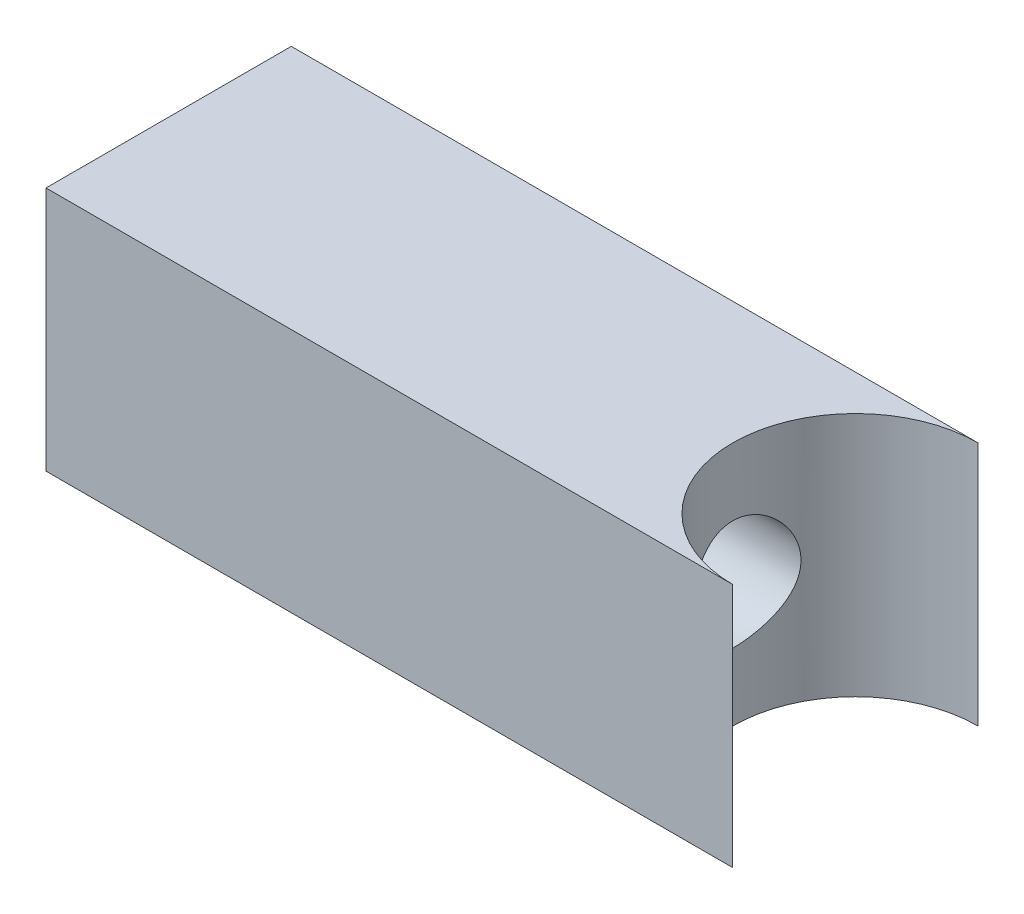
from build123d import *

# Parameters (mm, degrees)
SKETCH10_W                                           = 31.75
SKETCH10_H                                           = 31.75
SKETCH10_W_2                                         = 2.54
SKETCH10_H_2                                         = 5.08
SKETCH10_W_3                                         = 5.08
SKETCH10_H_3                                         = 2.54
BOSS_EXTRUDE3_DEPTH                                  = 12.7
SKETCH11_W                                           = 31.75
SKETCH11_H                                           = 31.75
BOSS_EXTRUDE4_DEPTH                                  = 76.2
CBORE_FOR_1_4_BINDING_HEAD_MACHINE_SCREW_D           = 6.7564
CBORE_FOR_1_4_BINDING_HEAD_MACHINE_SCREW_CBORE_D     = 14.2875
CBORE_FOR_1_4_BINDING_HEAD_MACHINE_SCREW_CBORE_DEPTH = 69.85
CUT_EXTRUDE1_DEPTH                                   = 31.75


with BuildPart() as part:
    # Sketch10 → Boss-Extrude3 (new body)
    # profile 1 of 9: a face of its own
    with BuildSketch(Plane(origin=(0, 0, 0), x_dir=(0, 0, -1), z_dir=(1, 0, 0))):
        Rectangle(SKETCH10_W, SKETCH10_H)
        Polygon((-2.54, 12.7), (2.54, 12.7), (12.7, 12.7), (12.7, 2.54), (12.7, -2.54), (12.7, -12.7), (2.54, -12.7), (-2.54, -12.7), (-12.7, -12.7), (-12.7, -2.54), (-12.7, 2.54), (-12.7, 12.7), align=None, mode=Mode.SUBTRACT)
    # profile 2 of 9: a face of its own
    with BuildSketch(Plane(origin=(0, 0, 0), x_dir=(0, 0, -1), z_dir=(1, 0, 0))):
        with Locations((11.43, 0)):
            Rectangle(SKETCH10_W_2, SKETCH10_H_2)
    # profile 3 of 9: a face of its own
    with BuildSketch(Plane(origin=(0, 0, 0), x_dir=(0, 0, -1), z_dir=(1, 0, 0))):
        with BuildLine():
            Line((10.16, -2.54), (10.16, 2.54))
            Line((10.16, 2.54), (10.16, 6.35))
            ThreePointArc((10.16, 6.35), (10.012022021, 6.580814495), (9.740509205, 6.542688341))
            Line((9.740509205, 6.542688341), (5.08, 2.54))
            Line((5.08, 2.54), (5.08, -2.54))
            Line((5.08, -2.54), (9.740509205, -6.542688341))
            ThreePointArc((9.740509205, -6.542688341), (10.012022021, -6.580814495), (10.16, -6.35))
            Line((10.16, -6.35), (10.16, -2.54))
        make_face()
    # profile 4 of 9: a face of its own
    with BuildSketch(Plane(origin=(0, 0, 0), x_dir=(0, 0, -1), z_dir=(1, 0, 0))):
        with Locations((0, -11.43)):
            Rectangle(SKETCH10_W_3, SKETCH10_H_3)
    # profile 5 of 9: a face of its own
    with BuildSketch(Plane(origin=(0, 0, 0), x_dir=(0, 0, -1), z_dir=(1, 0, 0))):
        with BuildLine():
            ThreePointArc((6.542688341, -9.740509205), (6.580814495, -10.012022021), (6.35, -10.16))
            Line((6.35, -10.16), (-6.35, -10.16))
            ThreePointArc((-6.35, -10.16), (-6.580814495, -10.012022021), (-6.542688341, -9.740509205))
            Line((-6.542688341, -9.740509205), (-2.54, -5.08))
            Line((-2.54, -5.08), (2.54, -5.08))
            Line((2.54, -5.08), (6.542688341, -9.740509205))
        make_face()
    # profile 6 of 9: a face of its own
    with BuildSketch(Plane(origin=(0, 0, 0), x_dir=(0, 0, -1), z_dir=(1, 0, 0))):
        with Locations((0, 11.43)):
            Rectangle(SKETCH10_W_3, SKETCH10_H_3)
    # profile 7 of 9: a face of its own
    with BuildSketch(Plane(origin=(0, 0, 0), x_dir=(0, 0, -1), z_dir=(1, 0, 0))):
        with BuildLine():
            Line((6.35, 10.16), (-6.35, 10.16))
            ThreePointArc((-6.35, 10.16), (-6.580814495, 10.012022021), (-6.542688341, 9.740509205))
            Line((-6.542688341, 9.740509205), (-2.54, 5.08))
            Line((-2.54, 5.08), (2.54, 5.08))
            Line((2.54, 5.08), (6.542688341, 9.740509205))
            ThreePointArc((6.542688341, 9.740509205), (6.580814495, 10.012022021), (6.35, 10.16))
        make_face()
    # profile 8 of 9: a face of its own
    with BuildSketch(Plane(origin=(0, 0, 0), x_dir=(0, 0, -1), z_dir=(1, 0, 0))):
        with BuildLine():
            Line((-5.08, 2.54), (-9.740509205, 6.542688341))
            ThreePointArc((-9.740509205, 6.542688341), (-10.012022021, 6.580814495), (-10.16, 6.35))
            Line((-10.16, 6.35), (-10.16, -6.35))
            ThreePointArc((-10.16, -6.35), (-10.012022021, -6.580814495), (-9.740509205, -6.542688341))
            Line((-9.740509205, -6.542688341), (-5.08, -2.54))
            Line((-5.08, -2.54), (-5.08, 2.54))
        make_face()
    # profile 9 of 9: a face of its own
    with BuildSketch(Plane(origin=(0, 0, 0), x_dir=(0, 0, -1), z_dir=(1, 0, 0))):
        with Locations((-11.43, 0)):
            Rectangle(SKETCH10_W_2, SKETCH10_H_2)
    extrude(amount=-BOSS_EXTRUDE3_DEPTH)

    # Sketch11 → Boss-Extrude4 (add)
    with BuildSketch(Plane(origin=(0, 0, 0), x_dir=(0, 0, -1), z_dir=(1, 0, 0))):
        Rectangle(SKETCH11_W, SKETCH11_H)
    extrude(amount=BOSS_EXTRUDE4_DEPTH)

    # CBORE for 1/4 Binding Head Machine Screw1 (through all)
    with Locations(Plane(origin=(76.2, 0, 0), x_dir=(0, 0, -1), z_dir=(1, 0, 0))):
        with Locations((0, 0)):
            CounterBoreHole(CBORE_FOR_1_4_BINDING_HEAD_MACHINE_SCREW_D / 2, CBORE_FOR_1_4_BINDING_HEAD_MACHINE_SCREW_CBORE_D / 2, CBORE_FOR_1_4_BINDING_HEAD_MACHINE_SCREW_CBORE_DEPTH)

    # Sketch15 → Cut-Extrude1 (cut)
    with BuildSketch(Plane(origin=(0, 15.875, 0), x_dir=(1, 0, 0), z_dir=(0, 1, 0))):
        with BuildLine():
            Line((76.2, 15.875), (76.2, -15.875))
            ThreePointArc((76.2, -15.875), (60.325, 0), (76.2, 15.875))
        make_face()
    extrude(amount=-CUT_EXTRUDE1_DEPTH, mode=Mode.SUBTRACT)


solid = part.part
